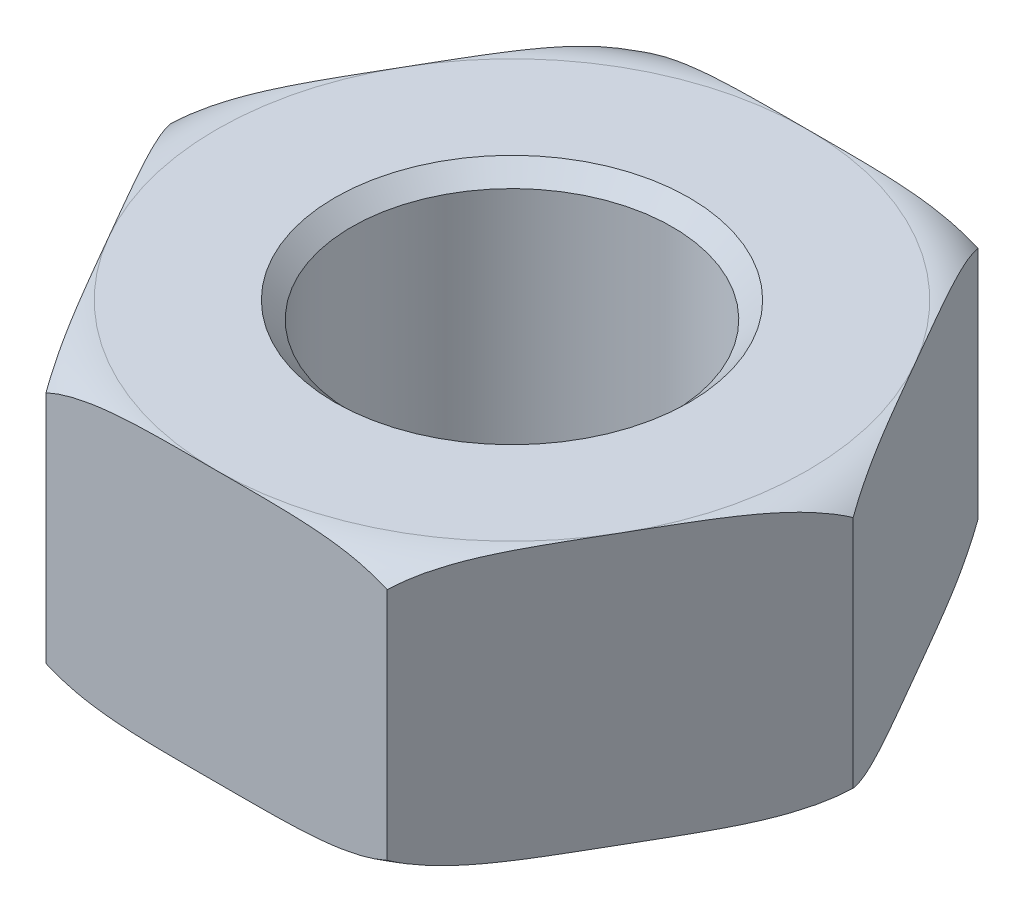
from build123d import *

# Parameters (mm, degrees)
SKETCH1_R           = 1.9
BOSS_EXTRUDE1_DEPTH = 1.6
CHAMFER1_SIZE       = 0.2


with BuildPart() as part:
    # Sketch1 → Boss-Extrude1 (new, symmetric)
    with BuildSketch(Plane(origin=(0, 0, 0), x_dir=(1, 0, 0), z_dir=(0, 1, 0))):
        Polygon((4.041451884, 0), (2.020725942, 3.5), (-2.020725942, 3.5), (-4.041451884, 0), (-2.020725942, -3.5), (2.020725942, -3.5), align=None)
        with Locations(Location((0, 0, 0), (0, 0, 270))):
            Circle(SKETCH1_R, mode=Mode.SUBTRACT)
    extrude(amount=BOSS_EXTRUDE1_DEPTH, both=True)

    # Sketch2 → Cut-Revolve1 (revolve, cut)
    with BuildSketch(Plane.XY):
        with BuildLine():
            Line((-4.3, -0.8), (-4.3, -1.6))
            Line((-4.3, -1.6), (-3.5, -1.6))
            ThreePointArc((-3.5, -1.6), (-4.065685425, -1.365685425), (-4.3, -0.8))
        make_face()
    cut_revolve1 = revolve(axis=Axis((0, 0, 0), (0, 1, 0)), mode=Mode.SUBTRACT)

    # Mirror2: Cut-Revolve1 across plane
    add(cut_revolve1.mirror(Plane.ZX), mode=Mode.SUBTRACT)

    # Chamfer1
    chamfer1_edges = [part.edges().sort_by_distance(p)[0] for p in [
        (0, -1.6, -1.9),
        (0, 1.6, -1.9),
    ]]
    chamfer(chamfer1_edges, length=CHAMFER1_SIZE)


solid = part.part
